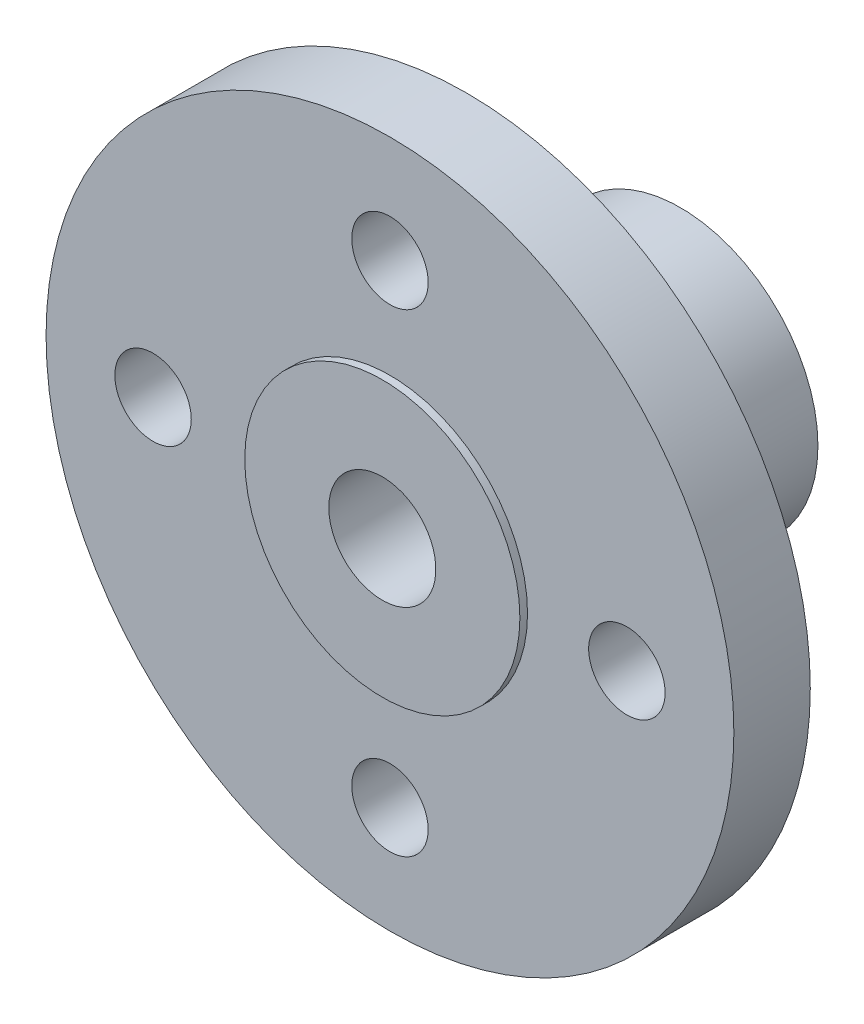
from build123d import *

# Parameters (mm, degrees)
SKETCH1_R                = 9
SKETCH1_R_2              = 3.4
SKETCH1_R_3              = 1
BOSS_EXTRUDE1_DEPTH      = 2
BOSS_EXTRUDE2_DEPTH      = 5.6
BOSS_EXTRUDE2_DEPTH_BACK = 2.2
SKETCH2_R                = 3.6
SKETCH2_R_2              = 1.4
SKETCH3_R                = 2.75
CUT_EXTRUDE1_DEPTH       = 5.6


with BuildPart() as part:
    # Sketch1 → Boss-Extrude1 (new body)
    with BuildSketch(Plane.XY):
        Circle(SKETCH1_R)
        Circle(SKETCH1_R_2, mode=Mode.SUBTRACT)
        with Locations((0, 6.2)):
            Circle(SKETCH1_R_3, mode=Mode.SUBTRACT)
        with Locations((6.2, 0)):
            Circle(SKETCH1_R_3, mode=Mode.SUBTRACT)
        with Locations((0, -6.2)):
            Circle(SKETCH1_R_3, mode=Mode.SUBTRACT)
        with Locations((-6.2, 0)):
            Circle(SKETCH1_R_3, mode=Mode.SUBTRACT)
    extrude(amount=BOSS_EXTRUDE1_DEPTH)

    # Sketch2 → Boss-Extrude2 (add, two sides: drawn at the far end of the back side and taken through both)
    with BuildSketch(Plane(origin=(0, 0, 0), x_dir=(-1, 0, 0), z_dir=(0, 0, -1)).offset(-BOSS_EXTRUDE2_DEPTH_BACK)):
        Circle(SKETCH2_R)
        Circle(SKETCH2_R_2, mode=Mode.SUBTRACT)
    extrude(amount=BOSS_EXTRUDE2_DEPTH + BOSS_EXTRUDE2_DEPTH_BACK)

    # Sketch3 → Cut-Extrude1 (cut)
    with BuildSketch(Plane(origin=(0, 0, -5.6), x_dir=(-1, 0, 0), z_dir=(0, 0, -1))):
        Circle(SKETCH3_R)
    extrude(amount=-CUT_EXTRUDE1_DEPTH, mode=Mode.SUBTRACT)


solid = part.part
